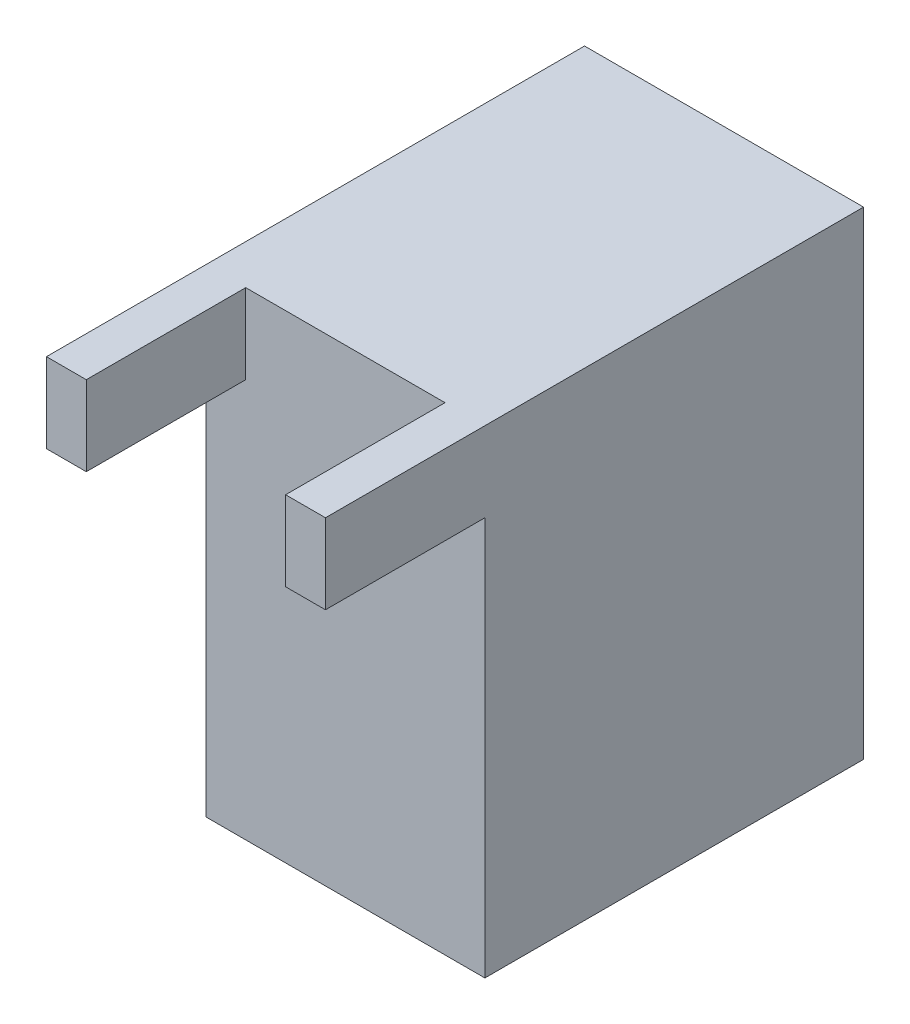
from build123d import *

# Parameters (mm, degrees)
SKETCH1_W           = 7
SKETCH1_H           = 9.5
BOSS_EXTRUDE1_DEPTH = 12
SKETCH3_R           = 3.15
CUT_EXTRUDE2_DEPTH  = 11
SKETCH4_W           = 1
SKETCH4_H           = 2
BOSS_EXTRUDE2_DEPTH = 4


with BuildPart() as part:
    # Sketch1 → Boss-Extrude1 (new body)
    with BuildSketch(Plane(origin=(0, 0, 0), x_dir=(1, 0, 0), z_dir=(0, 1, 0))):
        with Locations((1.651810585, 0.915738162)):
            Rectangle(SKETCH1_W, SKETCH1_H)
    extrude(amount=BOSS_EXTRUDE1_DEPTH)

    # Sketch3 → Cut-Extrude2 (cut)
    with BuildSketch(Plane.XZ):
        with Locations(Location((1.651810585, -0.165738162, 0), (0, 0, 270))):
            Circle(SKETCH3_R)
    extrude(amount=-CUT_EXTRUDE2_DEPTH, mode=Mode.SUBTRACT)

    # Sketch4 → Boss-Extrude2 (add)
    with BuildSketch(Plane.XY.offset(3.834261838)):
        with Locations((-1.348189415, 11)):
            Rectangle(SKETCH4_W, SKETCH4_H)
        with Locations((4.651810585, 11)):
            Rectangle(SKETCH4_W, SKETCH4_H)
    extrude(amount=BOSS_EXTRUDE2_DEPTH)


solid = part.part
